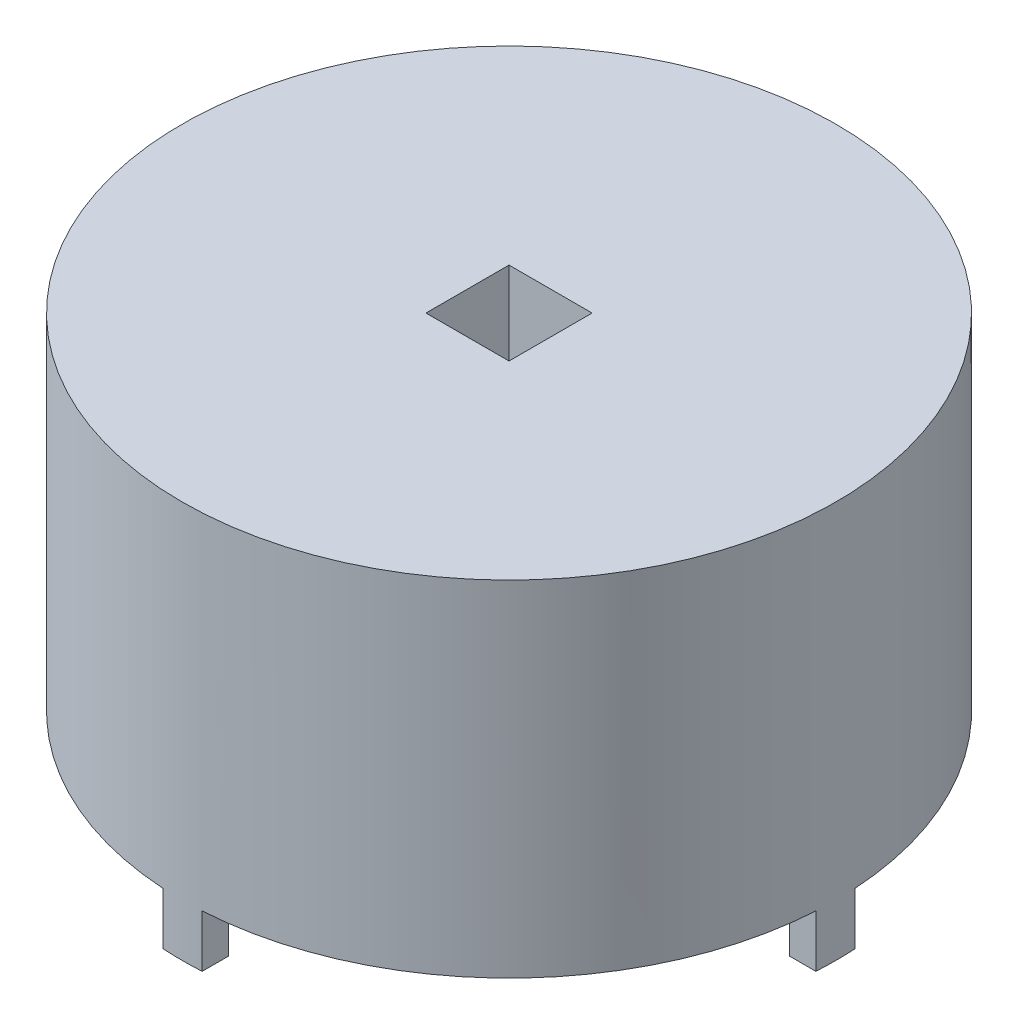
from build123d import *
from build123d.topology import SkipClean

# Parameters (mm, degrees)
SKETCH1_R           = 25
SKETCH1_R_2         = 23
BOSS_EXTRUDE1_DEPTH = 10
BOSS_EXTRUDE2_DEPTH = 4
BOSS_EXTRUDE3_START = 6.35
SKETCH3_R           = 25
SKETCH3_W           = 6.35
SKETCH3_H           = 6.35
BOSS_EXTRUDE3_DEPTH = 6.35


with BuildPart() as part:
    # Sketch1 → Boss-Extrude1 (new, symmetric)
    with BuildSketch(Plane(origin=(0, 0, 0), x_dir=(1, 0, 0), z_dir=(0, 1, 0))):
        with Locations(Location((0, 0, 0), (0, 0, 270))):
            Circle(SKETCH1_R)
        with Locations(Location((0, 0, 0), (0, 0, 270))):
            Circle(SKETCH1_R_2, mode=Mode.SUBTRACT)
    extrude(amount=BOSS_EXTRUDE1_DEPTH, both=True)

    # Sketch2 → Boss-Extrude2 (add)
    with SkipClean():  # the faces are left unmerged after this step: merging them gives an invalid solid
        with BuildSketch(Plane.XZ.offset(10)):
            with BuildLine():
                ThreePointArc((-1.5, 22.951034835), (0, 23), (1.5, 22.951034835))
                Line((1.5, 22.951034835), (1.5, 24.954959427))
                ThreePointArc((1.5, 24.954959427), (0.750338033, 24.98873732), (0, 25))
                ThreePointArc((0, 25), (-0.750338033, 24.98873732), (-1.5, 24.954959427))
                Line((-1.5, 24.954959427), (-1.5, 22.951034835))
            make_face()
            with BuildLine():
                Line((-24.954959427, -1.5), (-22.951034835, -1.5))
                ThreePointArc((-22.951034835, -1.5), (-23, 0), (-22.951034835, 1.5))
                Line((-22.951034835, 1.5), (-24.954959427, 1.5))
                ThreePointArc((-24.954959427, 1.5), (-24.98873732, 0.750338033), (-25, 0))
                ThreePointArc((-25, 0), (-24.98873732, -0.750338033), (-24.954959427, -1.5))
            make_face()
            with BuildLine():
                ThreePointArc((23, 0), (22.987755449, -0.750399492), (22.951034835, -1.5))
                Line((22.951034835, -1.5), (24.954959427, -1.5))
                ThreePointArc((24.954959427, -1.5), (24.98873732, -0.750338033), (25, 0))
                ThreePointArc((25, 0), (24.98873732, 0.750338033), (24.954959427, 1.5))
                Line((24.954959427, 1.5), (22.951034835, 1.5))
                ThreePointArc((22.951034835, 1.5), (22.987755449, 0.750399492), (23, 0))
            make_face()
            with BuildLine():
                Line((1.5, -24.954959427), (1.5, -22.951034835))
                ThreePointArc((1.5, -22.951034835), (0, -23), (-1.5, -22.951034835))
                Line((-1.5, -22.951034835), (-1.5, -24.954959427))
                ThreePointArc((-1.5, -24.954959427), (-0.750338033, -24.98873732), (0, -25))
                ThreePointArc((0, -25), (0.750338033, -24.98873732), (1.5, -24.954959427))
            make_face()
        extrude(amount=BOSS_EXTRUDE2_DEPTH)

    # Sketch3 → Boss-Extrude3 (add)
    with SkipClean():  # the faces are left unmerged after this step: merging them gives an invalid solid
        with BuildSketch(Plane(origin=(0, 10, 0), x_dir=(1, 0, 0), z_dir=(0, 1, 0)).offset(BOSS_EXTRUDE3_START)):
            with Locations(Location((0, 0, 0), (0, 0, 86.560187232))):
                Circle(SKETCH3_R)
            Rectangle(SKETCH3_W, SKETCH3_H, mode=Mode.SUBTRACT)
        extrude(amount=-BOSS_EXTRUDE3_DEPTH)


solid = part.part
